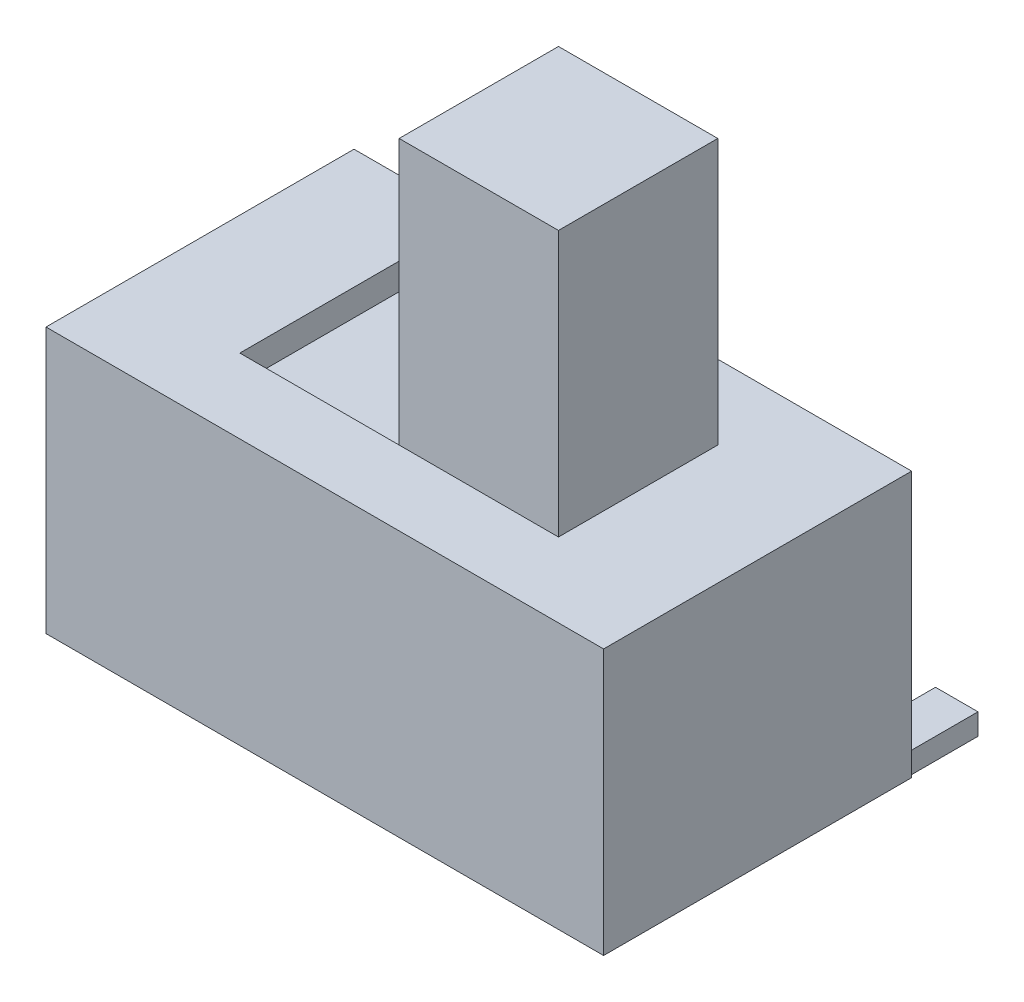
from build123d import *

# Parameters (mm, degrees)
SKETCH1_W           = 10.5
SKETCH1_H           = 5
BOSS_EXTRUDE1_DEPTH = 5.8
SKETCH2_W           = 6
SKETCH2_H           = 3
CUT_EXTRUDE1_DEPTH  = 0.5
SKETCH3_W           = 3
SKETCH3_H           = 3
BOSS_EXTRUDE2_DEPTH = 5.5
BOSS_EXTRUDE3_DEPTH = 0.4
LPATTERN1_COUNT     = 2
LPATTERN1_PITCH     = 3
LPATTERN1_COL_COUNT = 2
LPATTERN1_COL_PITCH = 3


with BuildPart() as part:
    # Sketch1 → Boss-Extrude1 (new body)
    with BuildSketch(Plane.XY):
        with Locations((0, 2.5)):
            Rectangle(SKETCH1_W, SKETCH1_H)
    extrude(amount=BOSS_EXTRUDE1_DEPTH)

    # Sketch2 → Cut-Extrude1 (cut)
    with BuildSketch(Plane(origin=(0, 5, 0), x_dir=(1, 0, 0), z_dir=(0, 1, 0))):
        with Locations((0, -2.9)):
            Rectangle(SKETCH2_W, SKETCH2_H)
    extrude(amount=-CUT_EXTRUDE1_DEPTH, mode=Mode.SUBTRACT)

    # Sketch3 → Boss-Extrude2 (add)
    with BuildSketch(Plane(origin=(0, 4.5, 0), x_dir=(1, 0, 0), z_dir=(0, 1, 0))):
        with Locations((1.5, -2.9)):
            Rectangle(SKETCH3_W, SKETCH3_H)
    extrude(amount=BOSS_EXTRUDE2_DEPTH)

    # Sketch4 → Boss-Extrude3 (add, symmetric)
    with BuildSketch(Plane(origin=(0, 0, 0), x_dir=(0, 0, -1), z_dir=(1, 0, 0))):
        with BuildLine():
            Line((-2.7, 0), (-2.7, -0.8))
            ThreePointArc((-2.7, -0.8), (-2.524264069, -1.224264069), (-2.1, -1.4))
            Line((-2.1, -1.4), (3.1, -1.4))
            Line((3.1, -1.4), (3.1, -1.8))
            Line((3.1, -1.8), (-2.1, -1.8))
            ThreePointArc((-2.1, -1.8), (-2.807106781, -1.507106781), (-3.1, -0.8))
            Line((-3.1, -0.8), (-3.1, 0))
            Line((-3.1, 0), (-2.7, 0))
        make_face()
    boss_extrude3 = extrude(amount=BOSS_EXTRUDE3_DEPTH, both=True)

    # LPattern1: Boss-Extrude3 ×2
    with Locations(*[(-i * LPATTERN1_PITCH, 0, 0) for i in range(1, LPATTERN1_COUNT)]):
        add(boss_extrude3)

    # LPattern1 col: Boss-Extrude3 ×2
    with Locations(*[(i * LPATTERN1_COL_PITCH, 0, 0) for i in range(1, LPATTERN1_COL_COUNT)]):
        add(boss_extrude3)


solid = part.part
